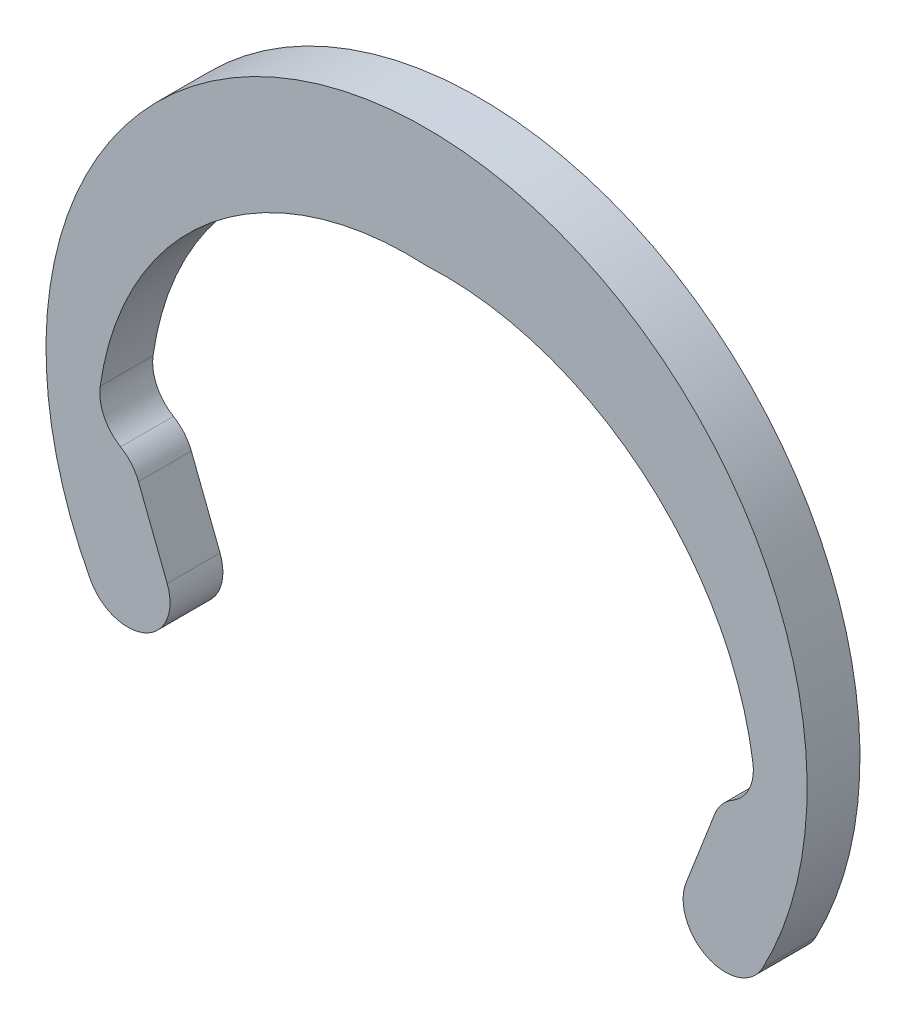
from build123d import *

# Parameters (mm, degrees)
EXTRUSION1_DEPTH = 1


with BuildPart() as part:
    # Esquisse1 → Extrusion1 (new body)
    with BuildSketch(Plane.XY):
        with BuildLine():
            Line((5.45058398, -1.312131796), (4.907576652, -2.710396092))
            ThreePointArc((4.907576652, -2.710396092), (5.320441767, -3.72745699), (6.359982311, -3.375))
            ThreePointArc((6.359982311, -3.375), (0, 7.2), (-6.359982311, -3.375))
            ThreePointArc((-6.359982311, -3.375), (-5.320441767, -3.72745699), (-4.907576652, -2.710396092))
            Line((-4.907576652, -2.710396092), (-5.45058398, -1.312131796))
            ThreePointArc((-5.45058398, -1.312131796), (-5.58638878, -1.084069901), (-5.789339137, -0.91299587))
            ThreePointArc((-5.789339137, -0.91299587), (-6.103454982, -0.570684122), (-6.174372427, -0.111536201))
            ThreePointArc((-6.174372427, -0.111536201), (-4.07266037, 3.620779969), (0, 4.947737042))
            ThreePointArc((0, 4.947737042), (4.07266037, 3.620779969), (6.174372427, -0.111536201))
            ThreePointArc((6.174372427, -0.111536201), (6.103454982, -0.570684122), (5.789339137, -0.91299587))
            ThreePointArc((5.789339137, -0.91299587), (5.58638878, -1.084069901), (5.45058398, -1.312131796))
        make_face()
    extrude(amount=EXTRUSION1_DEPTH)


solid = part.part
